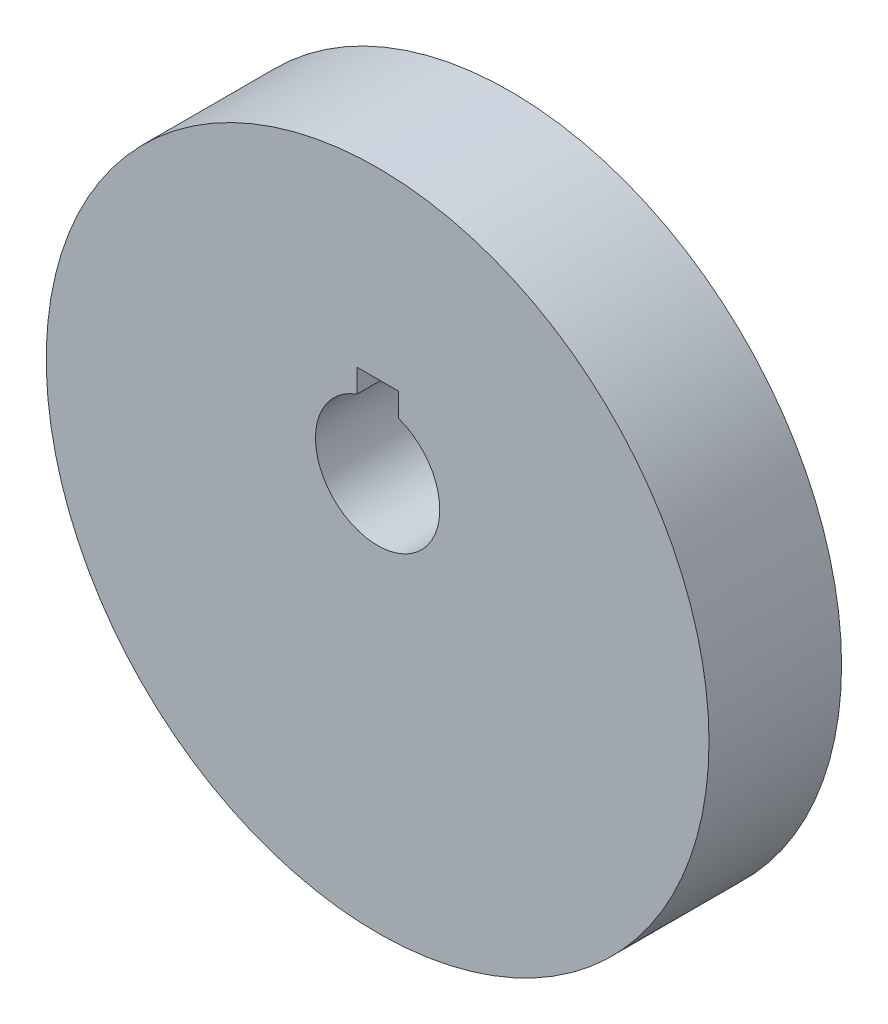
from build123d import *

# Parameters (mm, degrees)
SKETCH1_R               = 25.4
BOSS_EXTRUDE1_DEPTH     = 10.16
CUT_EXTRUDE2_DEPTH      = 12.16
CUT_EXTRUDE2_DEPTH_BACK = 12.16
SKETCH2_R               = 4.7625
CUT_EXTRUDE4_DEPTH      = 12.16
CUT_EXTRUDE4_DEPTH_BACK = 12.16
SKETCH3_W               = 3.175
SKETCH3_H               = 3.90525


with BuildPart() as part:
    # Sketch1 → Boss-Extrude1 (new body)
    with BuildSketch(Plane.XY):
        with Locations((0, -5.08)):
            Circle(SKETCH1_R)
    extrude(amount=BOSS_EXTRUDE1_DEPTH)

    # Sketch2 → Cut-Extrude2 (cut, two sides: drawn at the far end of the back side and taken through both)
    with BuildSketch(Plane.XY.offset(-CUT_EXTRUDE2_DEPTH_BACK)):
        Circle(SKETCH2_R)
    extrude(amount=CUT_EXTRUDE2_DEPTH + CUT_EXTRUDE2_DEPTH_BACK, mode=Mode.SUBTRACT)

    # Sketch3 → Cut-Extrude4 (cut, two sides: drawn at the far end of the back side and taken through both)
    with BuildSketch(Plane.XY.offset(-CUT_EXTRUDE4_DEPTH_BACK)):
        with Locations((0, 4.333875)):
            Rectangle(SKETCH3_W, SKETCH3_H)
    extrude(amount=CUT_EXTRUDE4_DEPTH + CUT_EXTRUDE4_DEPTH_BACK, mode=Mode.SUBTRACT)


solid = part.part
